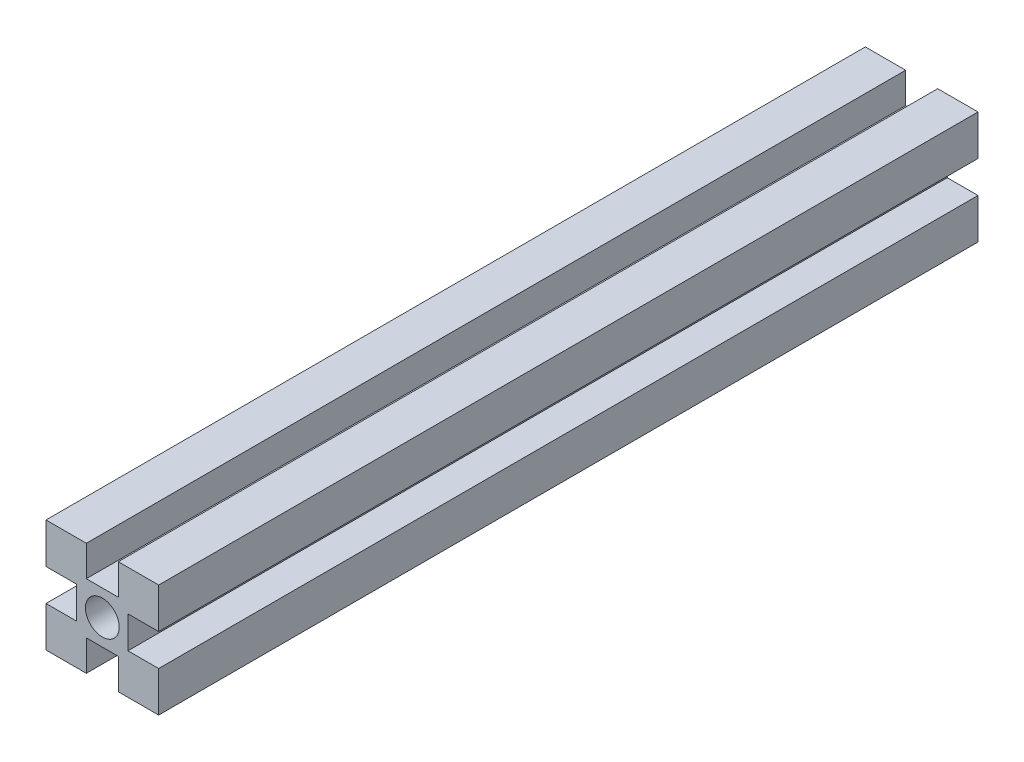
from build123d import *

# Parameters (mm, degrees)
BOSS_EXTRU_1_DEPTH = 160


with BuildPart() as part:
    # Esquisse1 → Boss.-Extru.1 (new body)
    with BuildSketch(Plane.XY):
        Polygon((3.125, 11), (11, 11), (11, 3.125), (5, 3.125), (5, -3.125), (11, -3.125), (11, -11), (3.125, -11), (3.125, -5), (-3.125, -5), (-3.125, -11), (-11, -11), (-11, -3.125), (-5, -3.125), (-5, 3.125), (-11, 3.125), (-11, 11), (-3.125, 11), (-3.125, 5), (3.125, 5), align=None)
    extrude(amount=BOSS_EXTRU_1_DEPTH)

    # Esquisse3 → Dégagement M61 (revolve, cut)
    with BuildSketch(Plane(origin=(0, 0, 160), x_dir=(0, -1, 0), z_dir=(1, 0, 0))):
        Polygon((0, 0), (0, 25), (3.3, 23.017159957), (3.3, 0), align=None)
    d_gagement_m61 = revolve(axis=Axis((0, 0, 166.35), (0, 0, -1)), mode=Mode.SUBTRACT)

    # Symétrie1: Dégagement M61 across plane
    add(d_gagement_m61.mirror(Plane.XY.offset(80)), mode=Mode.SUBTRACT)


solid = part.part
